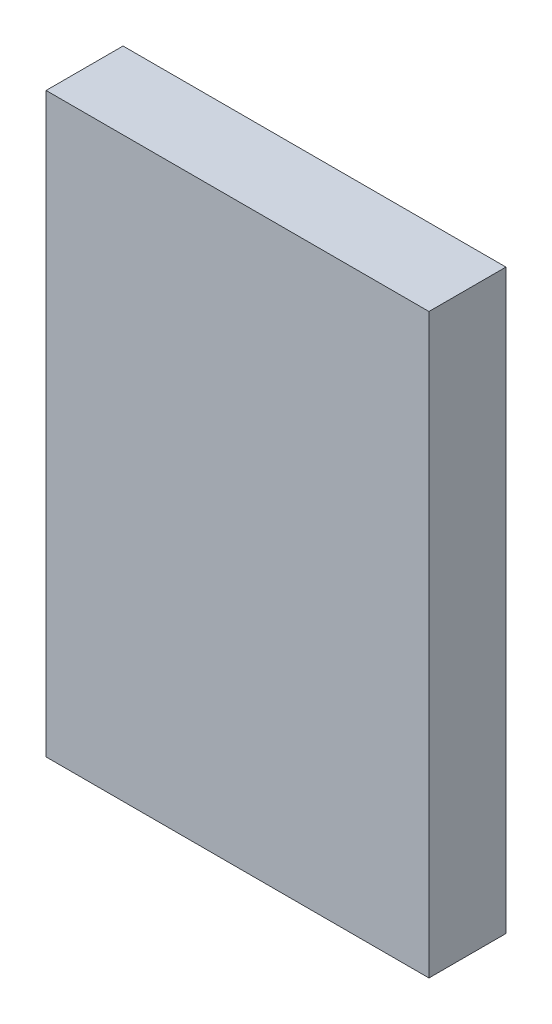
from build123d import *

# Parameters (mm, degrees)
SKETCH1_W           = 9.95
SKETCH1_H           = 15
BOSS_EXTRUDE1_DEPTH = 2


with BuildPart() as part:
    # Sketch1 → Boss-Extrude1 (new body)
    with BuildSketch(Plane.XY):
        Rectangle(SKETCH1_W, SKETCH1_H)
    extrude(amount=BOSS_EXTRUDE1_DEPTH)


solid = part.part
